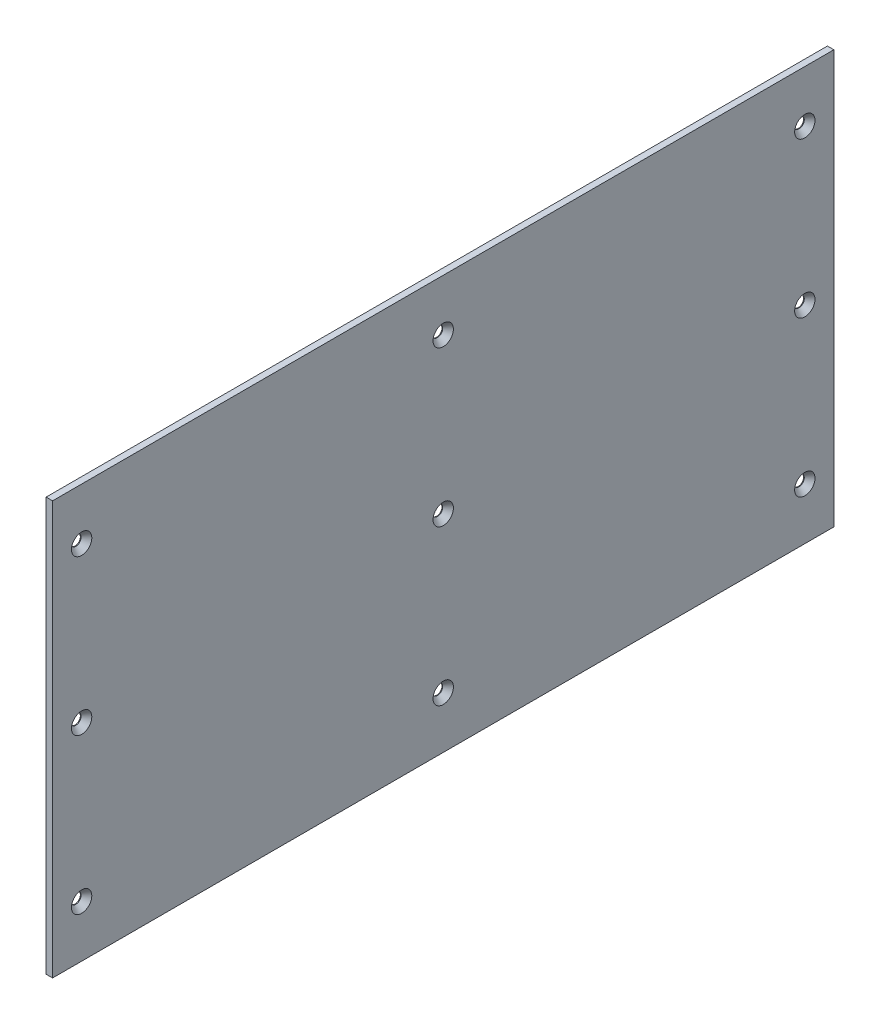
from build123d import *

# Parameters (mm, degrees)
SKETCH1_W                                    = 384.175
SKETCH1_H                                    = 203.2
BOSS_EXTRUDE1_DEPTH                          = 3.175
CSK_FOR_10_FLAT_HEAD_MACHINE_SCREW1_AT_COUNT = 2
CSK_FOR_10_FLAT_HEAD_MACHINE_SCREW1_AT_PITCH = 76.2
CSK_FOR_10_FLAT_HEAD_MACHINE_SCREW1_2_COUNT  = 2
CSK_FOR_10_FLAT_HEAD_MACHINE_SCREW1_2_PITCH  = 152.4
CSK_FOR_10_FLAT_HEAD_MACHINE_SCREW1_3_COUNT  = 2
CSK_FOR_10_FLAT_HEAD_MACHINE_SCREW1_3_PITCH  = 177.8
CSK_FOR_10_FLAT_HEAD_MACHINE_SCREW1_4_COUNT  = 2
CSK_FOR_10_FLAT_HEAD_MACHINE_SCREW1_4_PITCH  = 193.440636889
CSK_FOR_10_FLAT_HEAD_MACHINE_SCREW1_5_COUNT  = 2
CSK_FOR_10_FLAT_HEAD_MACHINE_SCREW1_5_PITCH  = 234.176429215
CSK_FOR_10_FLAT_HEAD_MACHINE_SCREW1_6_COUNT  = 2
CSK_FOR_10_FLAT_HEAD_MACHINE_SCREW1_6_PITCH  = 363.672655007
CSK_FOR_10_FLAT_HEAD_MACHINE_SCREW1_7_COUNT  = 2
CSK_FOR_10_FLAT_HEAD_MACHINE_SCREW1_7_PITCH  = 386.881273778


with BuildPart() as part:
    # Sketch1 → Boss-Extrude1 (new body)
    with BuildSketch(Plane(origin=(0, 0, 0), x_dir=(0, 0, -1), z_dir=(1, 0, 0))):
        with Locations((4.459397375, -26.930668258)):
            Rectangle(SKETCH1_W, SKETCH1_H)
    extrude(amount=BOSS_EXTRUDE1_DEPTH)

    # Sketch6 → CSK for #10 Flat Head Machine Screw1 (revolve, cut)
    with BuildSketch(Plane(origin=(3.175, 49.269331742, 173.340602625), x_dir=(0, 0, -1), z_dir=(0, 1, 0))):
        Polygon((0, 0), (0, 3.175), (2.5527, 3.175), (2.5527, 2.815182832), (4.9999011, 0), align=None)
    csk_for_10_flat_head_machine_screw1 = revolve(axis=Axis((9.525, 49.269331742, 173.340602625), (-1, 0, 0)), mode=Mode.SUBTRACT)

    # CSK for #10 Flat Head Machine Screw1 at: CSK for #10 Flat Head Machine Screw1 ×2
    with Locations(*[(0, -i * CSK_FOR_10_FLAT_HEAD_MACHINE_SCREW1_AT_PITCH, 0) for i in range(1, CSK_FOR_10_FLAT_HEAD_MACHINE_SCREW1_AT_COUNT)]):
        add(csk_for_10_flat_head_machine_screw1, mode=Mode.SUBTRACT)

    # CSK for _10 Flat Head Machine Screw1 2: CSK for #10 Flat Head Machine Screw1 ×2
    with Locations(*[(0, -i * CSK_FOR_10_FLAT_HEAD_MACHINE_SCREW1_2_PITCH, 0) for i in range(1, CSK_FOR_10_FLAT_HEAD_MACHINE_SCREW1_2_COUNT)]):
        add(csk_for_10_flat_head_machine_screw1, mode=Mode.SUBTRACT)

    # CSK for _10 Flat Head Machine Screw1 3: CSK for #10 Flat Head Machine Screw1 ×2
    with Locations(*[(0, 0, -i * CSK_FOR_10_FLAT_HEAD_MACHINE_SCREW1_3_PITCH) for i in range(1, CSK_FOR_10_FLAT_HEAD_MACHINE_SCREW1_3_COUNT)]):
        add(csk_for_10_flat_head_machine_screw1, mode=Mode.SUBTRACT)

    # CSK for _10 Flat Head Machine Screw1 4: CSK for #10 Flat Head Machine Screw1 ×2
    with Locations(*[Vector(0, -0.39391929857916763, -0.9191450300180579) * (i * CSK_FOR_10_FLAT_HEAD_MACHINE_SCREW1_4_PITCH) for i in range(1, CSK_FOR_10_FLAT_HEAD_MACHINE_SCREW1_4_COUNT)]):
        add(csk_for_10_flat_head_machine_screw1, mode=Mode.SUBTRACT)

    # CSK for _10 Flat Head Machine Screw1 5: CSK for #10 Flat Head Machine Screw1 ×2
    with Locations(*[Vector(0, -0.6507913734559685, -0.7592566023652967) * (i * CSK_FOR_10_FLAT_HEAD_MACHINE_SCREW1_5_PITCH) for i in range(1, CSK_FOR_10_FLAT_HEAD_MACHINE_SCREW1_5_COUNT)]):
        add(csk_for_10_flat_head_machine_screw1, mode=Mode.SUBTRACT)

    # CSK for _10 Flat Head Machine Screw1 6: CSK for #10 Flat Head Machine Screw1 ×2
    with Locations(*[Vector(0, -0.2095290887308736, -0.9778024140774095) * (i * CSK_FOR_10_FLAT_HEAD_MACHINE_SCREW1_6_PITCH) for i in range(1, CSK_FOR_10_FLAT_HEAD_MACHINE_SCREW1_6_COUNT)]):
        add(csk_for_10_flat_head_machine_screw1, mode=Mode.SUBTRACT)

    # CSK for _10 Flat Head Machine Screw1 7: CSK for #10 Flat Head Machine Screw1 ×2
    with Locations(*[Vector(0, -0.3939192985791678, -0.9191450300180579) * (i * CSK_FOR_10_FLAT_HEAD_MACHINE_SCREW1_7_PITCH) for i in range(1, CSK_FOR_10_FLAT_HEAD_MACHINE_SCREW1_7_COUNT)]):
        add(csk_for_10_flat_head_machine_screw1, mode=Mode.SUBTRACT)

    # Sketch8 → CSK for #10 Flat Head Machine Screw2 (revolve, cut)
    with BuildSketch(Plane(origin=(3.175, 49.269331742, -182.259397375), x_dir=(0, 0, -1), z_dir=(0, 1, 0))):
        Polygon((0, 0), (0, 3.175), (2.5527, 3.175), (2.5527, 2.815182832), (4.9999011, 0), align=None)
    revolve(axis=Axis((9.525, 49.269331742, -182.259397375), (-1, 0, 0)), mode=Mode.SUBTRACT)


solid = part.part
